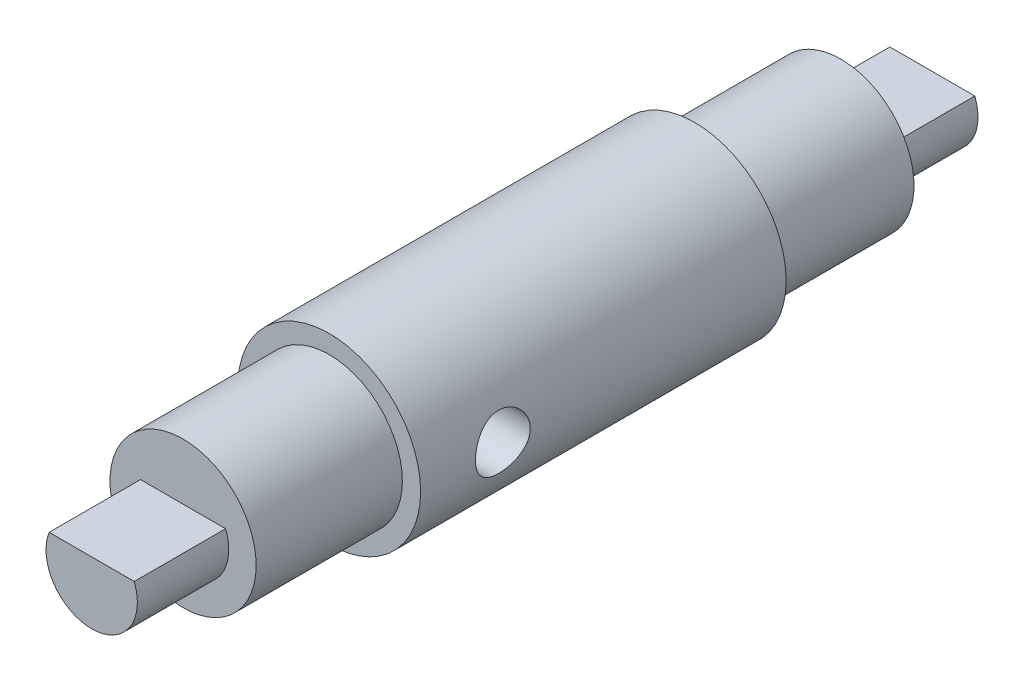
from build123d import *

# Parameters (mm, degrees)
SKETCH1_R           = 5
BOSS_EXTRUDE1_DEPTH = 20
SKETCH2_R           = 3.5
BOSS_EXTRUDE2_DEPTH = 8
BOSS_EXTRUDE3_START = 8
SKETCH3_R           = 3.5
BOSS_EXTRUDE3_DEPTH = 8
BOSS_EXTRUDE4_DEPTH = 5
BOSS_EXTRUDE5_START = 5
BOSS_EXTRUDE5_DEPTH = 5
SKETCH7_R           = 1.5
CUT_EXTRUDE1_DEPTH  = 15
BOSS_EXTRUDE6_REACH = 43.605
SKETCH8_R           = 4
BOSS_EXTRUDE7_REACH = 43.605
SKETCH9_R           = 4


with BuildPart() as part:
    # Sketch1 → Boss-Extrude1 (new body)
    with BuildSketch(Plane.XY):
        Circle(SKETCH1_R)
    extrude(amount=BOSS_EXTRUDE1_DEPTH)

    # Sketch2 → Boss-Extrude2 (add)
    with BuildSketch(Plane.XY.offset(20)):
        Circle(SKETCH2_R)
    extrude(amount=BOSS_EXTRUDE2_DEPTH)

    # Sketch3 → Boss-Extrude3 (add)
    with BuildSketch(Plane(origin=(0, 0, 0), x_dir=(-1, 0, 0), z_dir=(0, 0, -1)).offset(BOSS_EXTRUDE3_START)):
        with Locations(Location((0, 0, 0), (0, 0, 180))):
            Circle(SKETCH3_R)
    extrude(amount=-BOSS_EXTRUDE3_DEPTH)

    # Sketch4 → Boss-Extrude4 (add)
    with BuildSketch(Plane(origin=(0, 0, -8), x_dir=(-1, 0, 0), z_dir=(0, 0, -1))):
        with BuildLine():
            Line((2.326935409, 0.913986654), (-2.326935409, 0.913986654))
            ThreePointArc((-2.326935409, 0.913986654), (-0.465113684, -2.456352837), (2.5, 0))
            ThreePointArc((2.5, 0), (2.456352837, 0.465113684), (2.326935409, 0.913986654))
        make_face()
    extrude(amount=BOSS_EXTRUDE4_DEPTH)

    # Sketch6 → Boss-Extrude5 (add)
    with BuildSketch(Plane.XY.offset(28).offset(BOSS_EXTRUDE5_START)):
        with BuildLine():
            Line((2.32849737, 0.91), (-2.32849737, 0.91))
            ThreePointArc((-2.32849737, 0.91), (-0.46301003, -2.456750234), (2.5, 0))
            ThreePointArc((2.5, 0), (2.456750234, 0.46301003), (2.32849737, 0.91))
        make_face()
    extrude(amount=-BOSS_EXTRUDE5_DEPTH)

    # Sketch7 → Cut-Extrude1 (cut)
    with BuildSketch(Plane.ZY.offset(5)):
        with Locations((15.5, 0)):
            Circle(SKETCH7_R)
    extrude(amount=-CUT_EXTRUDE1_DEPTH, mode=Mode.SUBTRACT)

    # Sketch8 → Boss-Extrude6 (add, up to next)
    with BuildSketch(Plane(origin=(0, 0, -8), x_dir=(-1, 0, 0), z_dir=(0, 0, -1)), mode=Mode.PRIVATE) as boss_extrude6_sk1:
        Circle(SKETCH8_R)
    boss_extrude6_tool1 = extrude(boss_extrude6_sk1.sketch, amount=-BOSS_EXTRUDE6_REACH, mode=Mode.PRIVATE) - part.part
    add(boss_extrude6_tool1.solids().sort_by_distance((0, 0, -8))[0])

    # Sketch9 → Boss-Extrude7 (add, up to next)
    with BuildSketch(Plane.XY.offset(28), mode=Mode.PRIVATE) as boss_extrude7_sk1:
        with Locations(Location((0, 0, 0), (0, 0, 180))):
            Circle(SKETCH9_R)
    boss_extrude7_tool1 = extrude(boss_extrude7_sk1.sketch, amount=-BOSS_EXTRUDE7_REACH, mode=Mode.PRIVATE) - part.part
    add(boss_extrude7_tool1.solids().sort_by_distance((0, 0, 28))[0])


solid = part.part
